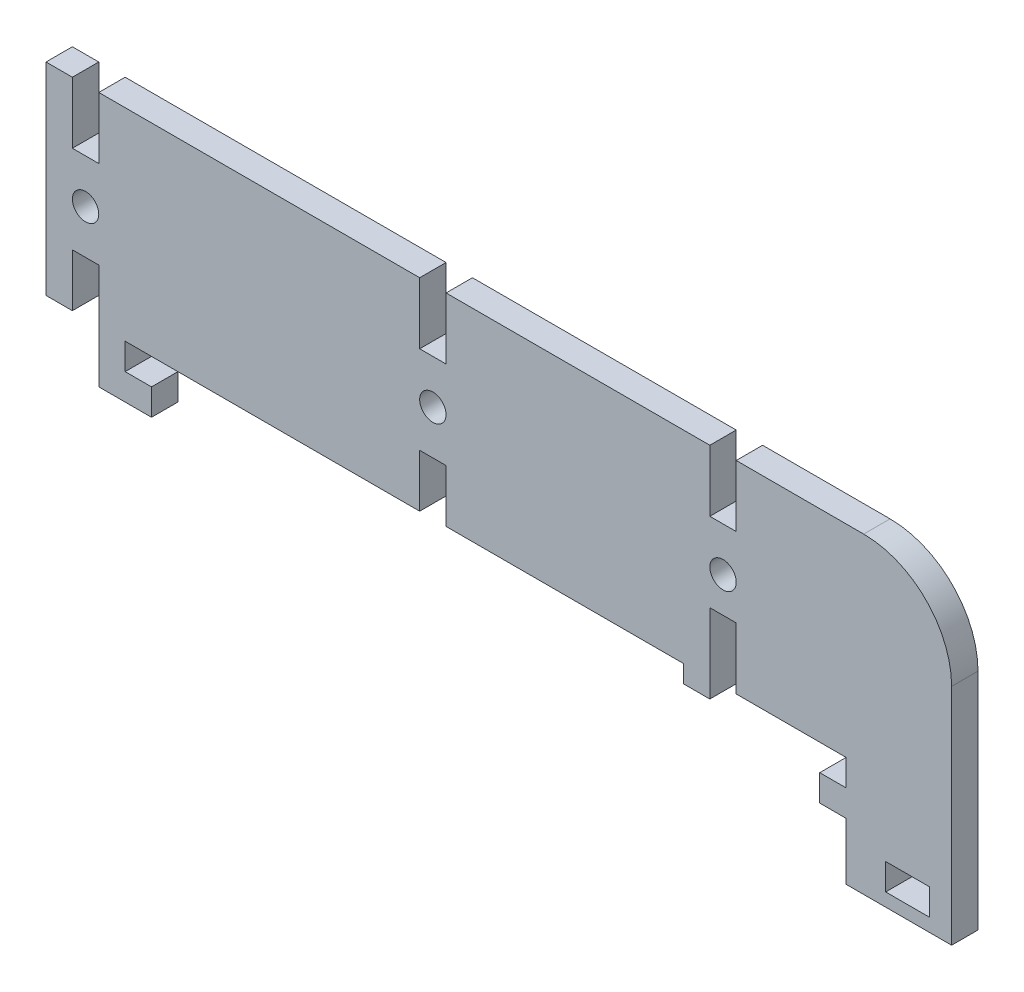
from build123d import *

# Parameters (mm, degrees)
SKETCH_1_R      = 1.5
SKETCH_1_W      = 5
SKETCH_1_H      = 3
EXTRUDE_1_DEPTH = 3


with BuildPart() as part:
    # 草图1 → 凸台-拉伸1 (new body)
    with BuildSketch(Plane.XY):
        with BuildLine():
            Line((0, 63.169976396), (0, 40.169976396))
            Line((0, 40.169976396), (3, 40.169976396))
            Line((3, 40.169976396), (3, 46.169976396))
            Line((3, 46.169976396), (6, 46.169976396))
            Line((6, 46.169976396), (6, 34.169976396))
            Line((6, 34.169976396), (12, 34.169976396))
            Line((12, 34.169976396), (12, 37.169976396))
            Line((12, 37.169976396), (9, 37.169976396))
            Line((9, 37.169976396), (9, 40.169976396))
            Line((9, 40.169976396), (42.5, 40.169976396))
            Line((42.5, 40.169976396), (42.5, 46.169976396))
            Line((42.5, 46.169976396), (45.5, 46.169976396))
            Line((45.5, 46.169976396), (45.5, 40.169976396))
            Line((45.5, 40.169976396), (72.5, 40.169976396))
            Line((72.5, 40.169976396), (72.5, 38.169976396))
            Line((72.5, 38.169976396), (75.5, 38.169976396))
            Line((75.5, 38.169976396), (75.5, 47.169976396))
            Line((75.5, 47.169976396), (78.5, 47.169976396))
            Line((78.5, 47.169976396), (78.5, 40.169976396))
            Line((78.5, 40.169976396), (91, 40.169976396))
            Line((91, 40.169976396), (91, 37.169976396))
            Line((91, 37.169976396), (88, 37.169976396))
            Line((88, 37.169976396), (88, 34.169976396))
            Line((88, 34.169976396), (91, 34.169976396))
            Line((91, 34.169976396), (91, 27.669976396))
            Line((91, 27.669976396), (103, 27.669976396))
            Line((103, 27.669976396), (103, 53.169976396))
            ThreePointArc((103, 53.169976396), (100.071067812, 60.241044208), (93, 63.169976396))
            Line((93, 63.169976396), (78.5, 63.169976396))
            Line((78.5, 63.169976396), (78.5, 56.169976396))
            Line((78.5, 56.169976396), (75.5, 56.169976396))
            Line((75.5, 56.169976396), (75.5, 63.169976396))
            Line((75.5, 63.169976396), (45.5, 63.169976396))
            Line((45.5, 63.169976396), (45.5, 56.169976396))
            Line((45.5, 56.169976396), (42.5, 56.169976396))
            Line((42.5, 56.169976396), (42.5, 63.169976396))
            Line((42.5, 63.169976396), (6, 63.169976396))
            Line((6, 63.169976396), (6, 56.169976396))
            Line((6, 56.169976396), (3, 56.169976396))
            Line((3, 56.169976396), (3, 63.169976396))
            Line((3, 63.169976396), (0, 63.169976396))
        make_face()
        with Locations((4.5, 51.169976396)):
            Circle(SKETCH_1_R, mode=Mode.SUBTRACT)
        with Locations((44, 51.169976396)):
            Circle(SKETCH_1_R, mode=Mode.SUBTRACT)
        with Locations((77, 51.169976396)):
            Circle(SKETCH_1_R, mode=Mode.SUBTRACT)
        with Locations((98, 30.669976396)):
            Rectangle(SKETCH_1_W, SKETCH_1_H, mode=Mode.SUBTRACT)
    extrude(amount=EXTRUDE_1_DEPTH)


solid = part.part
